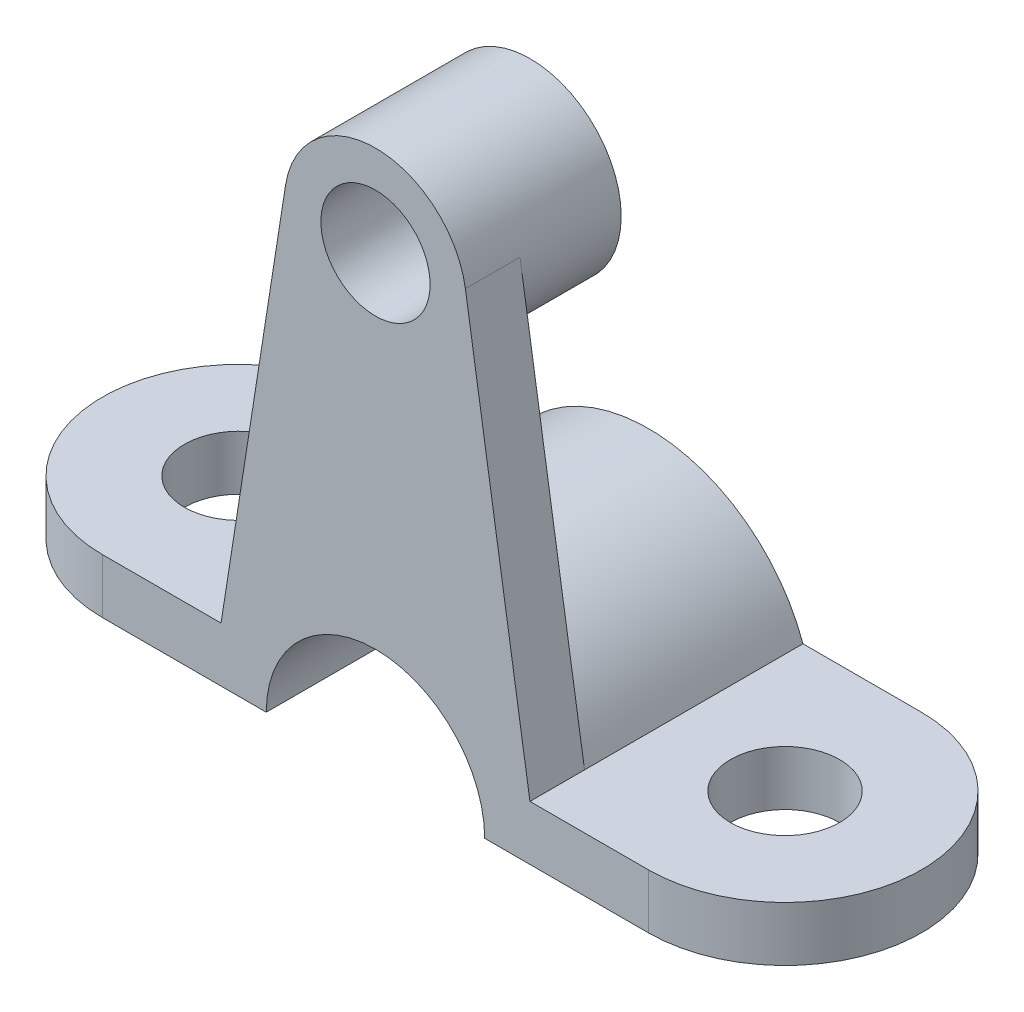
from build123d import *

# Parameters (mm, degrees)
BOSS_EXTRUDE1_DEPTH = 30
BOSS_EXTRUDE2_DEPTH = 12
SKETCH4_R           = 20
BOSS_EXTRUDE3_DEPTH = 34
SKETCH4_3_R         = 12
CUT_EXTRUDE1_DEPTH  = 34
BOSS_EXTRUDE4_DEPTH = 12
SKETCH5_R           = 12
CUT_EXTRUDE2_DEPTH  = 144.291935896


with BuildPart() as part:
    # Sketch2 → Boss-Extrude1 (new, symmetric)
    with BuildSketch(Plane.XY):
        with BuildLine():
            Line((-36, 0), (-24, 0))
            ThreePointArc((-24, 0), (0, 24), (24, 0))
            Line((24, 0), (36, 0))
            ThreePointArc((36, 0), (0, 36), (-36, 0))
        make_face()
    extrude(amount=BOSS_EXTRUDE1_DEPTH, both=True)

    # Sketch3 → Boss-Extrude2 (add)
    with BuildSketch(Plane(origin=(0, 0, 0), x_dir=(1, 0, 0), z_dir=(0, 1, 0))):
        with BuildLine():
            Line((36, 30), (60, 30))
            ThreePointArc((60, 30), (90, 0), (60, -30))
            Line((60, -30), (36, -30))
            Line((36, -30), (30, -30))
            Line((30, -30), (30, 30))
            Line((30, 30), (36, 30))
        make_face()
        with BuildLine():
            Line((-30, 30), (-36, 30))
            Line((-36, 30), (-60, 30))
            ThreePointArc((-60, 30), (-90, 0), (-60, -30))
            Line((-60, -30), (-36, -30))
            Line((-36, -30), (-30, -30))
            Line((-30, -30), (-30, 30))
        make_face()
    extrude(amount=BOSS_EXTRUDE2_DEPTH)



with BuildPart() as body_2:
    # Sketch4 → Boss-Extrude3 (new body)
    with BuildSketch(Plane.XY.offset(30)):
        with Locations((0, 99.389845389)):
            Circle(SKETCH4_R)
    extrude(amount=-BOSS_EXTRUDE3_DEPTH)

    # Sketch4<3> → Cut-Extrude1 (cut)
    with BuildSketch(Plane.XY.offset(30)):
        with Locations((0, 99.389845389)):
            Circle(SKETCH4_3_R)
    extrude(amount=-CUT_EXTRUDE1_DEPTH, mode=Mode.SUBTRACT)


with BuildPart() as part_1:
    add(part.part)

    add(body_2.part)  # Boss-Extrude4 merges body 2
    # Sketch4<4> → Boss-Extrude4 (add)
    with BuildSketch(Plane.XY.offset(30)):
        with BuildLine():
            ThreePointArc((-33.941125497, 12), (0, 36), (33.941125497, 12))
            Line((33.941125497, 12), (19.75877981, 102.486718075))
            ThreePointArc((19.75877981, 102.486718075), (0, 79.389845389), (-19.75877981, 102.486718075))
            Line((-19.75877981, 102.486718075), (-33.941125497, 12))
        make_face()
    extrude(amount=-BOSS_EXTRUDE4_DEPTH)

    # Sketch5 → Cut-Extrude2 (cut, through all)
    with BuildSketch(Plane(origin=(0, 12, 0), x_dir=(1, 0, 0), z_dir=(0, 1, 0))):
        with Locations((-60, 0)):
            Circle(SKETCH5_R)
    cut_extrude2 = extrude(amount=-CUT_EXTRUDE2_DEPTH, mode=Mode.SUBTRACT)

    # Mirror1: Cut-Extrude2 across plane
    add(cut_extrude2.mirror(Plane(origin=(0, 0, 0), x_dir=(0, 0, 1), z_dir=(1, 0, 0))), mode=Mode.SUBTRACT)


solid = part_1.part
